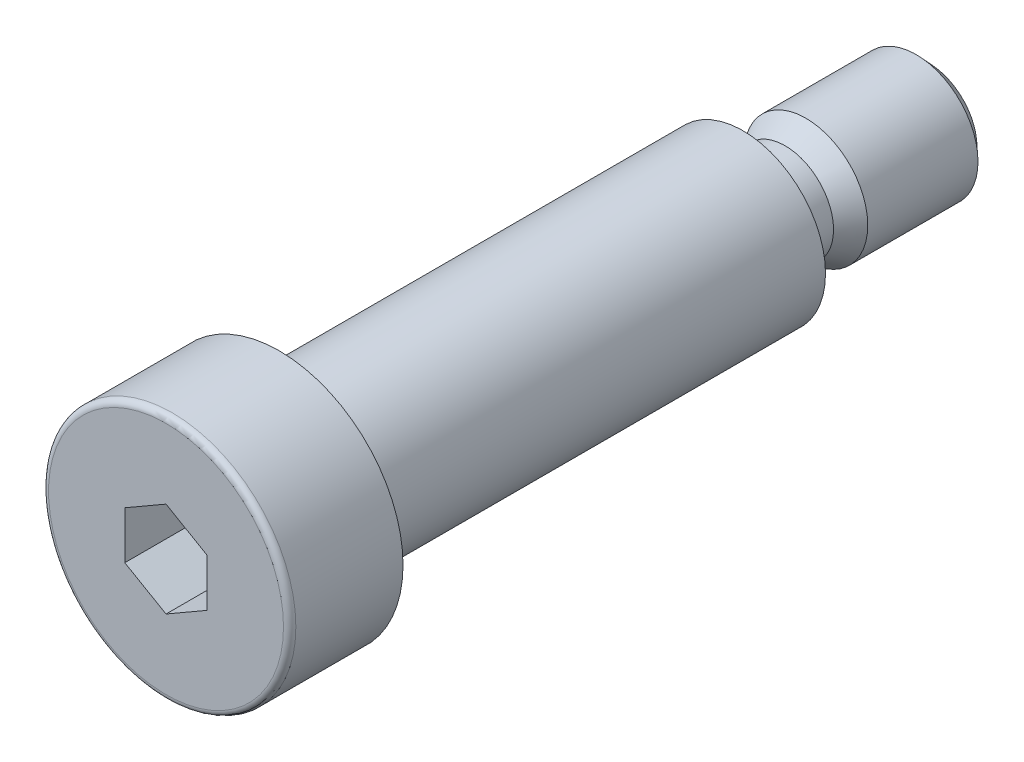
from build123d import *

# Parameters (mm, degrees)
SZKIC1_W                   = 4.7
SZKIC1_H                   = 4.08
WYTNIJ_WYCI_GNI_CIE1_DEPTH = 6.6
ZAOKR_GLENIE1_R            = 0.6


with BuildPart() as part:
    # Szkic1 → Obrót1 (revolve)
    with BuildSketch(Plane(origin=(0, 0, 0), x_dir=(1, 0, 0), z_dir=(0, 1, 0)), mode=Mode.PRIVATE) as obr_t1_sk:
        Polygon((0, -33.5), (0, -22.5), (-8, -22.5), (-12, -22.5), (-12, -33.5), align=None)
        Polygon((0, -22.5), (0, 22.5), (-4.7, 22.5), (-8, 22.5), (-8, -22.5), align=None)
        with Locations((-2.35, 24.54)):
            Rectangle(SZKIC1_W, SZKIC1_H)
        Polygon((-4.7, 26.58), (0, 26.58), (0, 40.5), (-4.7, 40.5), (-6, 39.3), (-6, 28.6), align=None)
    revolve(obr_t1_sk.sketch.rotate(Axis((0, 0, 33.5), (0, 0, -1)), 180), axis=Axis((0, 0, 33.5), (0, 0, -1)))

    # Szkic2 → Wytnij-wyciągnięcie1 (cut)
    with BuildSketch(Plane.XY.offset(33.5)):
        Polygon((4, 2.309401077), (0, 4.618802154), (-4, 2.309401077), (-4, -2.309401077), (0, -4.618802154), (4, -2.309401077), align=None)
    extrude(amount=-WYTNIJ_WYCI_GNI_CIE1_DEPTH, mode=Mode.SUBTRACT)

    # Zaokrąglenie1
    zaokr_glenie1_edges = [part.edges().sort_by_distance(p)[0] for p in [
        (-12, 0, 33.5),
    ]]
    fillet(zaokr_glenie1_edges, radius=ZAOKR_GLENIE1_R)


solid = part.part
